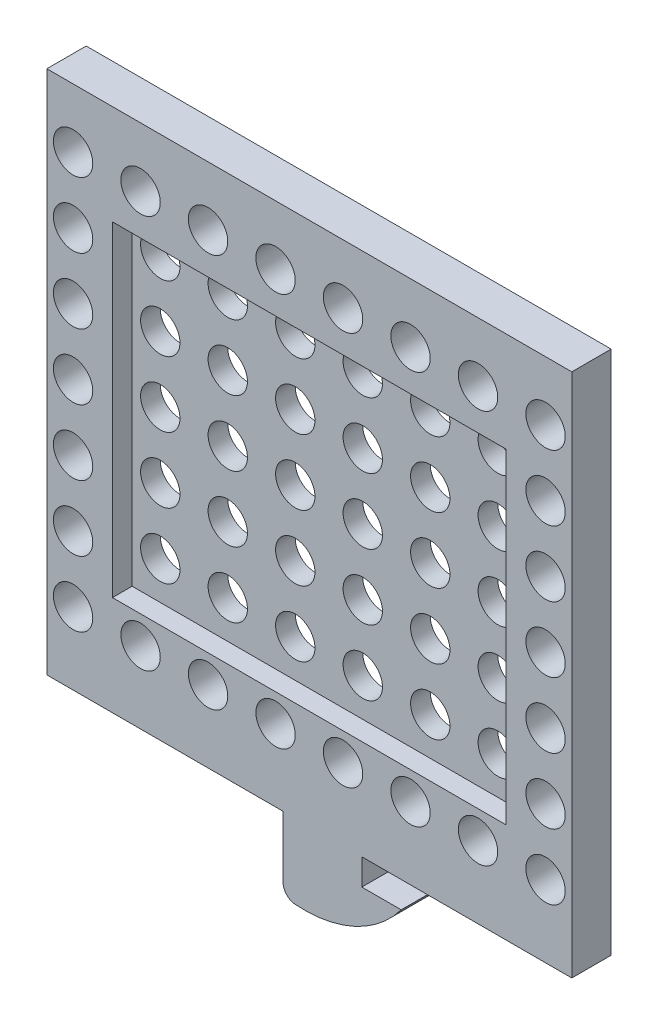
from build123d import *

# Parameters (mm, degrees)
BOSS_EXTRU_1_DEPTH      = 3
ESQUISSE2_R             = 1.5
ENL_V_MAT_EXTRU_1_DEPTH = 48.507894081
ESQUISSE4_W             = 30
ESQUISSE4_H             = 24.796786232
ENL_V_MAT_EXTRU_3_DEPTH = 1.5
CONG_2_R                = 1


with BuildPart() as part:
    # Esquisse1 → Boss.-Extru.1 (new body)
    with BuildSketch(Plane.XY):
        with BuildLine():
            Line((-18, 2), (0, 2))
            Line((0, 2), (0, 0))
            Line((0, 0), (0, -3.563243554))
            ThreePointArc((0, -3.563243554), (5.005734949, -3.059001354), (9, 0))
            Line((9, 0), (6, 0))
            Line((6, 0), (6, 2))
            Line((6, 2), (22, 2))
            Line((22, 2), (22, 42))
            Line((22, 42), (-18, 42))
            Line((-18, 42), (-18, 2))
        make_face()
    extrude(amount=BOSS_EXTRU_1_DEPTH)

    # Esquisse2 → Enlèv. mat.-Extru.1 (cut, through all)
    with BuildSketch(Plane.XY.offset(3)):
        with Locations((-16, 37.48988726)):
            Circle(ESQUISSE2_R)
        with Locations((-10.857142857, 37.48988726)):
            Circle(ESQUISSE2_R)
        with Locations((-5.714285714, 37.48988726)):
            Circle(ESQUISSE2_R)
        with Locations((-0.571428571, 37.48988726)):
            Circle(ESQUISSE2_R)
        with Locations((4.571428571, 37.48988726)):
            Circle(ESQUISSE2_R)
        with Locations((9.714285714, 37.48988726)):
            Circle(ESQUISSE2_R)
        with Locations((14.857142857, 37.48988726)):
            Circle(ESQUISSE2_R)
        with Locations((20, 37.48988726)):
            Circle(ESQUISSE2_R)
        with Locations((-10.857142857, 32.48988726)):
            Circle(ESQUISSE2_R)
        with Locations((-5.714285714, 32.48988726)):
            Circle(ESQUISSE2_R)
        with Locations((-0.571428571, 32.48988726)):
            Circle(ESQUISSE2_R)
        with Locations((4.571428571, 32.48988726)):
            Circle(ESQUISSE2_R)
        with Locations((9.714285714, 32.48988726)):
            Circle(ESQUISSE2_R)
        with Locations((14.857142857, 32.48988726)):
            Circle(ESQUISSE2_R)
        with Locations((-10.857142857, 27.48988726)):
            Circle(ESQUISSE2_R)
        with Locations((-5.714285714, 27.48988726)):
            Circle(ESQUISSE2_R)
        with Locations((-0.571428571, 27.48988726)):
            Circle(ESQUISSE2_R)
        with Locations((4.571428571, 27.48988726)):
            Circle(ESQUISSE2_R)
        with Locations((9.714285714, 27.48988726)):
            Circle(ESQUISSE2_R)
        with Locations((14.857142857, 27.48988726)):
            Circle(ESQUISSE2_R)
        with Locations((-10.857142857, 22.48988726)):
            Circle(ESQUISSE2_R)
        with Locations((-5.714285714, 22.48988726)):
            Circle(ESQUISSE2_R)
        with Locations((-0.571428571, 22.48988726)):
            Circle(ESQUISSE2_R)
        with Locations((4.571428571, 22.48988726)):
            Circle(ESQUISSE2_R)
        with Locations((9.714285714, 22.48988726)):
            Circle(ESQUISSE2_R)
        with Locations((14.857142857, 22.48988726)):
            Circle(ESQUISSE2_R)
        with Locations((-10.857142857, 17.48988726)):
            Circle(ESQUISSE2_R)
        with Locations((-5.714285714, 17.48988726)):
            Circle(ESQUISSE2_R)
        with Locations((-0.571428571, 17.48988726)):
            Circle(ESQUISSE2_R)
        with Locations((4.571428571, 17.48988726)):
            Circle(ESQUISSE2_R)
        with Locations((9.714285714, 17.48988726)):
            Circle(ESQUISSE2_R)
        with Locations((14.857142857, 17.48988726)):
            Circle(ESQUISSE2_R)
        with Locations((-10.857142857, 12.48988726)):
            Circle(ESQUISSE2_R)
        with Locations((-5.714285714, 12.48988726)):
            Circle(ESQUISSE2_R)
        with Locations((-0.571428571, 12.48988726)):
            Circle(ESQUISSE2_R)
        with Locations((4.571428571, 12.48988726)):
            Circle(ESQUISSE2_R)
        with Locations((9.714285714, 12.48988726)):
            Circle(ESQUISSE2_R)
        with Locations((14.857142857, 12.48988726)):
            Circle(ESQUISSE2_R)
        with Locations((-10.857142857, 7.48988726)):
            Circle(ESQUISSE2_R)
        with Locations((-5.714285714, 7.48988726)):
            Circle(ESQUISSE2_R)
        with Locations((-0.571428571, 7.48988726)):
            Circle(ESQUISSE2_R)
        with Locations((4.571428571, 7.48988726)):
            Circle(ESQUISSE2_R)
        with Locations((9.714285714, 7.48988726)):
            Circle(ESQUISSE2_R)
        with Locations((14.857142857, 7.48988726)):
            Circle(ESQUISSE2_R)
        with Locations((-16, 32.48988726)):
            Circle(ESQUISSE2_R)
        with Locations((-16, 27.48988726)):
            Circle(ESQUISSE2_R)
        with Locations((-16, 22.48988726)):
            Circle(ESQUISSE2_R)
        with Locations((-16, 17.48988726)):
            Circle(ESQUISSE2_R)
        with Locations((-16, 12.48988726)):
            Circle(ESQUISSE2_R)
        with Locations((-16, 7.48988726)):
            Circle(ESQUISSE2_R)
        with Locations((20, 32.48988726)):
            Circle(ESQUISSE2_R)
        with Locations((20, 27.48988726)):
            Circle(ESQUISSE2_R)
        with Locations((20, 22.48988726)):
            Circle(ESQUISSE2_R)
        with Locations((20, 17.48988726)):
            Circle(ESQUISSE2_R)
        with Locations((20, 12.48988726)):
            Circle(ESQUISSE2_R)
        with Locations((20, 7.48988726)):
            Circle(ESQUISSE2_R)
    extrude(amount=-ENL_V_MAT_EXTRU_1_DEPTH, mode=Mode.SUBTRACT)

    # Esquisse4 → Enlèv. mat.-Extru.3 (cut)
    with BuildSketch(Plane.XY.offset(3)):
        with Locations((2, 22)):
            Rectangle(ESQUISSE4_W, ESQUISSE4_H)
    extrude(amount=-ENL_V_MAT_EXTRU_3_DEPTH, mode=Mode.SUBTRACT)

    # Congé2
    cong_2_edges = [part.edges().sort_by_distance(p)[0] for p in [
        (0, -3.563243554, 1.5),
    ]]
    fillet(cong_2_edges, radius=CONG_2_R)


solid = part.part
